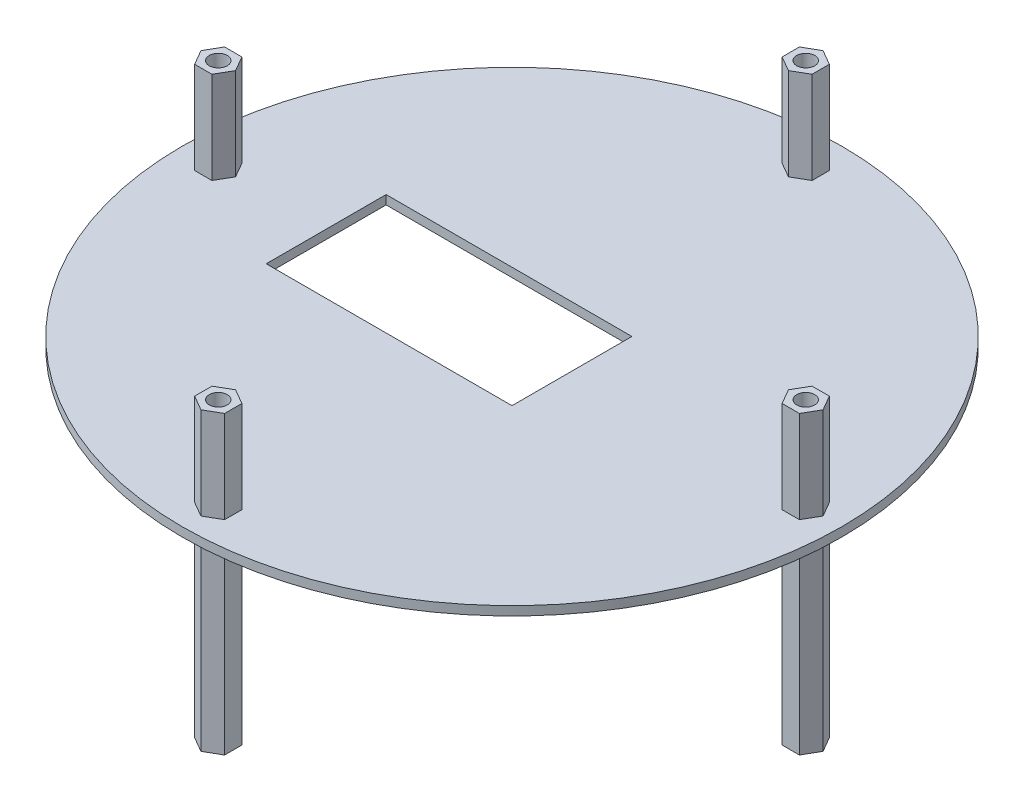
from build123d import *

# Parameters (mm, degrees)
SKETCH_1_R          = 55
EXTRUDE_1_DEPTH     = 1.5
SKETCH_2_W          = 41
SKETCH_2_H          = 20
CUT_EXTRUDE_1_DEPTH = 1.5
SKETCH_3_R          = 1.5
EXTRUDE_3_DEPTH     = 34
EXTRUDE_START       = 15.35
SKETCH_3_3_R        = 1.5
EXTRUDE_4_DEPTH     = 15.35


with BuildPart() as part:
    # 草图1 → 凸台-拉伸1 (new body)
    with BuildSketch(Plane(origin=(0, 0, 0), x_dir=(1, 0, 0), z_dir=(0, 1, 0))):
        Circle(SKETCH_1_R)
    extrude(amount=EXTRUDE_1_DEPTH)

    # 草图2 → 切除-拉伸1 (cut)
    with BuildSketch(Plane(origin=(0, 1.5, 0), x_dir=(1, 0, 0), z_dir=(0, 1, 0))):
        with Locations((-10.5, 0)):
            Rectangle(SKETCH_2_W, SKETCH_2_H)
    extrude(amount=-CUT_EXTRUDE_1_DEPTH, mode=Mode.SUBTRACT)

    # 草图3 → 凸台-拉伸3 (add)
    # profile 1 of 4: a face of its own
    with BuildSketch(Plane(origin=(0, 1.5, 0), x_dir=(1, 0, 0), z_dir=(0, 1, 0))):
        Polygon((-2.5, 47.556624327), (0, 46.113248654), (2.5, 47.556624327), (2.5, 50.443375673), (0, 51.886751346), (-2.5, 50.443375673), align=None)
        with Locations((0, 49)):
            Circle(SKETCH_3_R, mode=Mode.SUBTRACT)
    # profile 2 of 4: a face of its own
    with BuildSketch(Plane(origin=(0, 1.5, 0), x_dir=(1, 0, 0), z_dir=(0, 1, 0))):
        Polygon((-46.113248654, 0), (-47.556624327, 2.5), (-50.443375673, 2.5), (-51.886751346, 0), (-50.443375673, -2.5), (-47.556624327, -2.5), align=None)
        with Locations((-49, 0)):
            Circle(SKETCH_3_R, mode=Mode.SUBTRACT)
    # profile 3 of 4: a face of its own
    with BuildSketch(Plane(origin=(0, 1.5, 0), x_dir=(1, 0, 0), z_dir=(0, 1, 0))):
        Polygon((47.556624327, 2.5), (46.113248654, 0), (47.556624327, -2.5), (50.443375673, -2.5), (51.886751346, 0), (50.443375673, 2.5), align=None)
        with Locations((49, 0)):
            Circle(SKETCH_3_R, mode=Mode.SUBTRACT)
    # profile 4 of 4: a face of its own
    with BuildSketch(Plane(origin=(0, 1.5, 0), x_dir=(1, 0, 0), z_dir=(0, 1, 0))):
        Polygon((2.5, -47.556624327), (0, -46.113248654), (-2.5, -47.556624327), (-2.5, -50.443375673), (0, -51.886751346), (2.5, -50.443375673), align=None)
        with Locations((0, -49)):
            Circle(SKETCH_3_R, mode=Mode.SUBTRACT)
    extrude(amount=-EXTRUDE_3_DEPTH)

    # 草图3<3> → 凸台-拉伸4 (add)
    # profile 1 of 4: a face of its own
    with BuildSketch(Plane(origin=(0, 1.5, 0), x_dir=(1, 0, 0), z_dir=(0, 1, 0)).offset(EXTRUDE_START)):
        Polygon((-2.5, 47.556624327), (0, 46.113248654), (2.5, 47.556624327), (2.5, 50.443375673), (0, 51.886751346), (-2.5, 50.443375673), align=None)
        with Locations((0, 49)):
            Circle(SKETCH_3_3_R, mode=Mode.SUBTRACT)
    # profile 2 of 4: a face of its own
    with BuildSketch(Plane(origin=(0, 1.5, 0), x_dir=(1, 0, 0), z_dir=(0, 1, 0)).offset(EXTRUDE_START)):
        Polygon((-46.113248654, 0), (-47.556624327, 2.5), (-50.443375673, 2.5), (-51.886751346, 0), (-50.443375673, -2.5), (-47.556624327, -2.5), align=None)
        with Locations((-49, 0)):
            Circle(SKETCH_3_3_R, mode=Mode.SUBTRACT)
    # profile 3 of 4: a face of its own
    with BuildSketch(Plane(origin=(0, 1.5, 0), x_dir=(1, 0, 0), z_dir=(0, 1, 0)).offset(EXTRUDE_START)):
        Polygon((47.556624327, 2.5), (46.113248654, 0), (47.556624327, -2.5), (50.443375673, -2.5), (51.886751346, 0), (50.443375673, 2.5), align=None)
        with Locations((49, 0)):
            Circle(SKETCH_3_3_R, mode=Mode.SUBTRACT)
    # profile 4 of 4: a face of its own
    with BuildSketch(Plane(origin=(0, 1.5, 0), x_dir=(1, 0, 0), z_dir=(0, 1, 0)).offset(EXTRUDE_START)):
        Polygon((2.5, -47.556624327), (0, -46.113248654), (-2.5, -47.556624327), (-2.5, -50.443375673), (0, -51.886751346), (2.5, -50.443375673), align=None)
        with Locations((0, -49)):
            Circle(SKETCH_3_3_R, mode=Mode.SUBTRACT)
    extrude(amount=-EXTRUDE_4_DEPTH)


solid = part.part
